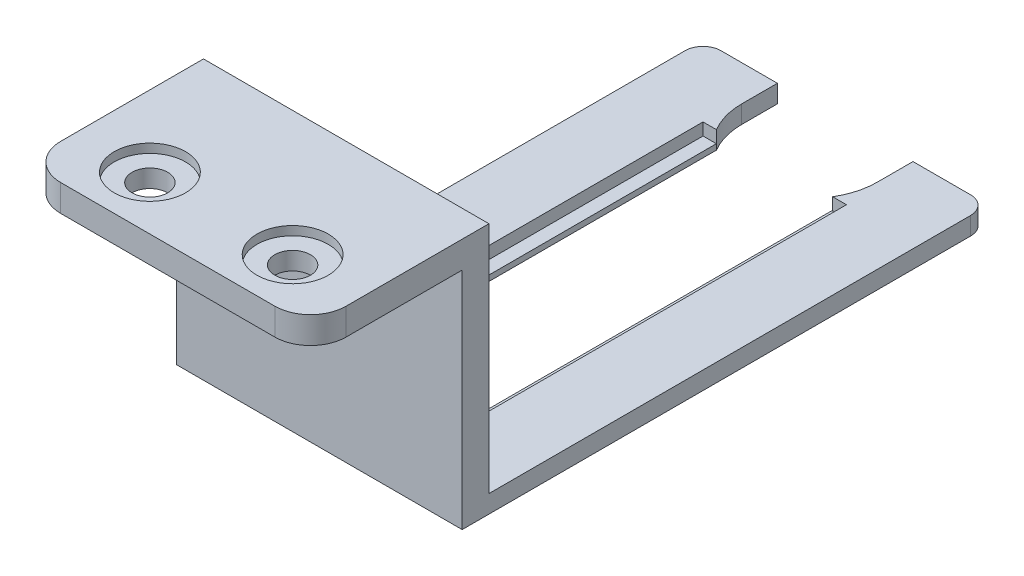
from build123d import *

# Parameters (mm, degrees)
SKETCH1_R           = 6.35
SKETCH1_R_2         = 3.175
BOSS_EXTRUDE1_DEPTH = 3.175
SKETCH1_3_R         = 6.35
BOSS_EXTRUDE2_DEPTH = 4.7625
FILLET1_R           = 6.35
SKETCH4_W           = 50.8
SKETCH4_H           = 4.7625
BOSS_EXTRUDE3_DEPTH = 40
SKETCH5_W           = 50.8
SKETCH5_H           = 3.175
BOSS_EXTRUDE4_DEPTH = 88.9
FILLET2_R           = 3.175
SKETCH11_W          = 25.527
SKETCH11_H          = 76.327
CUT_EXTRUDE2_DEPTH  = 125.625465933
SKETCH12_W          = 2.369732381
SKETCH12_H          = 76.327
SKETCH12_W_2        = 2.555200435
BOSS_EXTRUDE5_DEPTH = 1
CUT_EXTRUDE3_DEPTH  = 125.625465933


with BuildPart() as part:
    # Sketch1 → Boss-Extrude1 (new body)
    with BuildSketch(Plane(origin=(0, 0, 0), x_dir=(1, 0, 0), z_dir=(0, 1, 0))):
        Circle(SKETCH1_R)
        Circle(SKETCH1_R_2, mode=Mode.SUBTRACT)
    extrude(amount=BOSS_EXTRUDE1_DEPTH)

    # Sketch1<3> → Boss-Extrude2 (add)
    with BuildSketch(Plane(origin=(0, 0, 0), x_dir=(1, 0, 0), z_dir=(0, 1, 0))):
        Polygon((-12.7, 22.232248258), (-12.7, 0), (-12.7, -9.525), (12.7, -9.525), (12.7, 0), (12.7, 22.232248258), align=None)
        Circle(SKETCH1_3_R, mode=Mode.SUBTRACT)
    extrude(amount=BOSS_EXTRUDE2_DEPTH)

    # Mirror1: part across plane


with BuildPart() as part_1:
    add(part.part)
    add(part.part.mirror(Plane(origin=(12.7, 0, 0), x_dir=(0, 0, 1), z_dir=(1, 0, 0))))

    # Fillet1
    fillet1_edges = [part_1.edges().sort_by_distance(p)[0] for p in [
        (38.1, 2.38125, 9.525),
        (-12.7, 2.38125, 9.525),
    ]]
    fillet(fillet1_edges, radius=FILLET1_R)

    # Sketch4 → Boss-Extrude3 (add)
    with BuildSketch(Plane.XZ):
        with Locations((12.7, -19.850998258)):
            Rectangle(SKETCH4_W, SKETCH4_H)
    extrude(amount=BOSS_EXTRUDE3_DEPTH)

    # Sketch5 → Boss-Extrude4 (add)
    with BuildSketch(Plane(origin=(0, 0, -22.232248258), x_dir=(-1, 0, 0), z_dir=(0, 0, -1))):
        with Locations((-12.7, -38.4125)):
            Rectangle(SKETCH5_W, SKETCH5_H)
    extrude(amount=BOSS_EXTRUDE4_DEPTH)

    # Fillet2
    fillet2_edges = [part_1.edges().sort_by_distance(p)[0] for p in [
        (-12.7, -38.4125, -111.132248258),
        (38.1, -38.4125, -111.132248258),
    ]]
    fillet(fillet2_edges, radius=FILLET2_R)

    # Sketch11 → Cut-Extrude2 (cut, through all)
    with BuildSketch(Plane(origin=(0, -36.825, 0), x_dir=(1, 0, 0), z_dir=(0, 1, 0))):
        with Locations((12.6365, 60.395748258)):
            Rectangle(SKETCH11_W, SKETCH11_H)
    extrude(amount=-CUT_EXTRUDE2_DEPTH, mode=Mode.SUBTRACT)

    # Sketch12 → Boss-Extrude5 (add)
    with BuildSketch(Plane.XZ.offset(40)):
        with Locations((1.05786619, -60.395748258)):
            Rectangle(SKETCH12_W, SKETCH12_H)
        with Locations((24.122399783, -60.395748258)):
            Rectangle(SKETCH12_W_2, SKETCH12_H)
    extrude(amount=-BOSS_EXTRUDE5_DEPTH)

    # Sketch14 → Cut-Extrude3 (cut, through all)
    with BuildSketch(Plane(origin=(0, -36.825, 0), x_dir=(1, 0, 0), z_dir=(0, 1, 0))):
        with BuildLine():
            Line((0.534999946, 104.782248258), (0.534999946, 111.132248258))
            Line((0.534999946, 111.132248258), (24.664999946, 111.132248258))
            Line((24.664999946, 111.132248258), (24.664999946, 104.782248258))
            ThreePointArc((24.664999946, 104.782248258), (24.201028616, 101.468585813), (22.844799565, 98.409783604))
            Line((22.844799565, 98.409783604), (22.844799565, 98.559248258))
            Line((22.844799565, 98.559248258), (2.242732381, 98.559248258))
            Line((2.242732381, 98.559248258), (2.242732381, 98.594257179))
            ThreePointArc((2.242732381, 98.594257179), (0.96976654, 101.572591591), (0.534999946, 104.782248258))
        make_face()
    extrude(amount=-CUT_EXTRUDE3_DEPTH, mode=Mode.SUBTRACT)


solid = part_1.part
